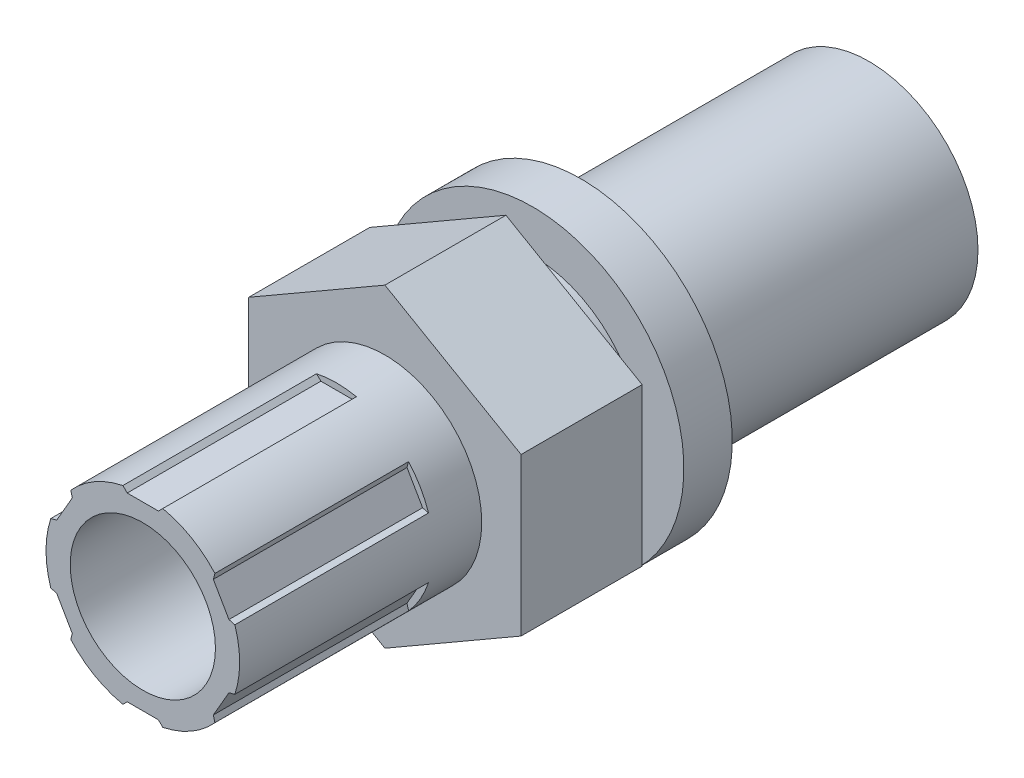
from build123d import *

# Parameters (mm, degrees)
BOSS_EXTRUDE1_DEPTH = 6.35
SKETCH2_R           = 5.08
SKETCH2_R_2         = 3.81
BOSS_EXTRUDE2_DEPTH = 12.7
SKETCH3_R           = 5.715
BOSS_EXTRUDE3_DEPTH = 19.05
SKETCH4_R           = 7.937190451
BOSS_EXTRUDE4_DEPTH = 2.54
SKETCH5_R           = 3.81
CUT_EXTRUDE1_DEPTH  = 28.860423741
CUT_EXTRUDE2_DEPTH  = 10.16
CIRPATTERN1_COUNT   = 6


with BuildPart() as part:
    # Sketch1 → Boss-Extrude1 (new body)
    with BuildSketch(Plane.XY):
        Polygon((0, 8.248891971), (-7.14375, 4.124445986), (-7.14375, -4.124445986), (0, -8.248891971), (7.14375, -4.124445986), (7.14375, 4.124445986), align=None)
    extrude(amount=BOSS_EXTRUDE1_DEPTH)

    # Sketch2 → Boss-Extrude2 (add)
    with BuildSketch(Plane.XY.offset(6.35)):
        Circle(SKETCH2_R)
        Circle(SKETCH2_R_2, mode=Mode.SUBTRACT)
    extrude(amount=BOSS_EXTRUDE2_DEPTH)

    # Sketch3 → Boss-Extrude3 (add)
    with BuildSketch(Plane(origin=(0, 0, 0), x_dir=(-1, 0, 0), z_dir=(0, 0, -1))):
        with Locations(Location((0, 0, 0), (0, 0, 180))):
            Circle(SKETCH3_R)
    extrude(amount=BOSS_EXTRUDE3_DEPTH)

    # Sketch4 → Boss-Extrude4 (add)
    with BuildSketch(Plane(origin=(0, 0, -1.397), x_dir=(-1, 0, 0), z_dir=(0, 0, -1))):
        Circle(SKETCH4_R)
    extrude(amount=BOSS_EXTRUDE4_DEPTH)

    # Sketch5 → Cut-Extrude1 (cut, through all)
    with BuildSketch(Plane.XY.offset(6.35)):
        Circle(SKETCH5_R)
    extrude(amount=-CUT_EXTRUDE1_DEPTH, mode=Mode.SUBTRACT)

    # Sketch6 → Cut-Extrude2 (cut)
    with BuildSketch(Plane.XY.offset(19.05)):
        Polygon((-0.818654099, 4.743933512), (0.818654099, 4.743933512), (1.27, 5.195279413), (-1.27, 5.195279413), align=None)
    cut_extrude2 = extrude(amount=-CUT_EXTRUDE2_DEPTH, mode=Mode.SUBTRACT)

    # CirPattern1: Cut-Extrude2 ×6 about axis
    cirpattern1_axis = Axis((0, 0, 0), (0, 0, 1))
    for i in range(1, CIRPATTERN1_COUNT):
        add(cut_extrude2.rotate(cirpattern1_axis, i * 360 / CIRPATTERN1_COUNT), mode=Mode.SUBTRACT)


solid = part.part
